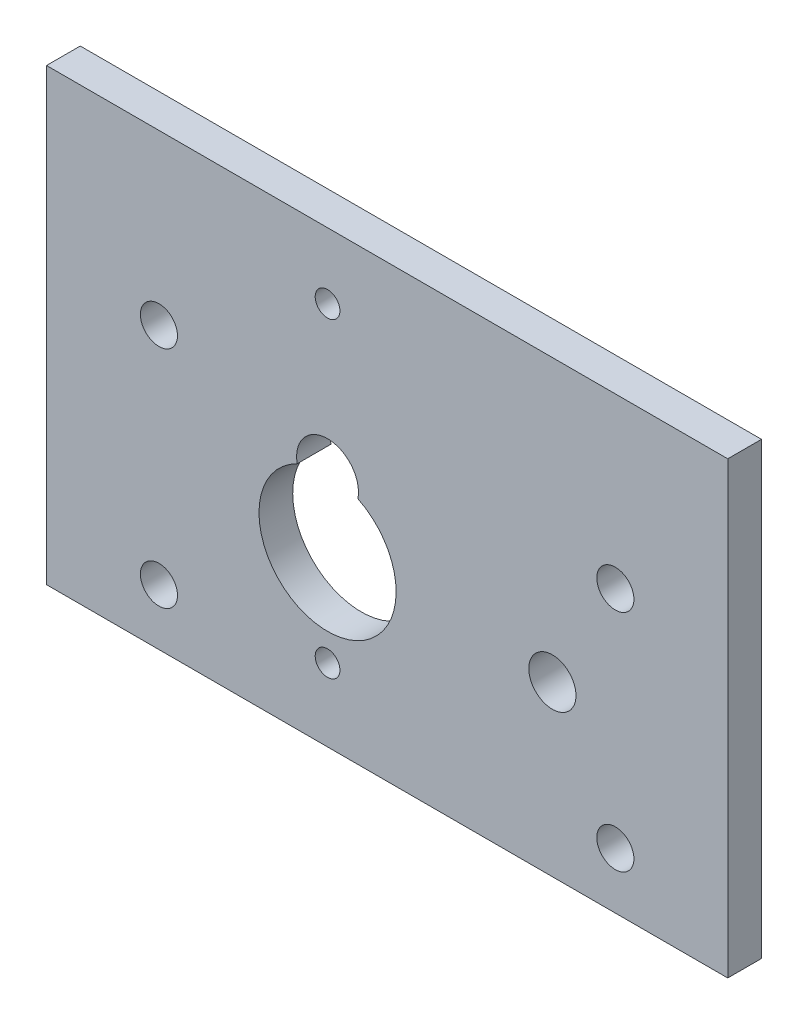
from build123d import *

# Parameters (mm, degrees)
SKETCH_1_W          = 60.6
SKETCH_1_H          = 40
EXTRUDE_1_DEPTH     = 3
SKETCH_2_R          = 2.75
SKETCH_2_R_2        = 6.1
SKETCH_2_R_3        = 1.1
SKETCH_2_R_4        = 2.1
CUT_EXTRUDE_1_DEPTH = 73.672966088
SKETCH_3_R          = 1.65
CUT_EXTRUDE_2_DEPTH = 13


with BuildPart() as part:
    # 草图1 → 凸台-拉伸1 (new body)
    with BuildSketch(Plane.XY):
        with Locations((30.3, 20)):
            Rectangle(SKETCH_1_W, SKETCH_1_H)
    extrude(amount=EXTRUDE_1_DEPTH)

    # 草图2 → 切除-拉伸1 (cut, through all)
    with BuildSketch(Plane(origin=(0, 0, 0), x_dir=(-1, 0, 0), z_dir=(0, 0, -1))):
        with Locations((-25, 21)):
            Circle(SKETCH_2_R)
        with Locations((-25, 15)):
            Circle(SKETCH_2_R_2)
        with Locations((-25, 6.46)):
            Circle(SKETCH_2_R_3)
        with Locations((-25, 34.14)):
            Circle(SKETCH_2_R_3)
        with Locations((-45, 15)):
            Circle(SKETCH_2_R_4)
    extrude(amount=-CUT_EXTRUDE_1_DEPTH, mode=Mode.SUBTRACT)

    # 草图3 → 切除-拉伸2 (cut)
    with BuildSketch(Plane.XY.offset(3)):
        with Locations((50.6, 5)):
            Circle(SKETCH_3_R)
        with Locations((50.6, 25)):
            Circle(SKETCH_3_R)
        with Locations((10, 25)):
            Circle(SKETCH_3_R)
        with Locations((10, 5)):
            Circle(SKETCH_3_R)
    extrude(amount=-CUT_EXTRUDE_2_DEPTH, mode=Mode.SUBTRACT)


solid = part.part
